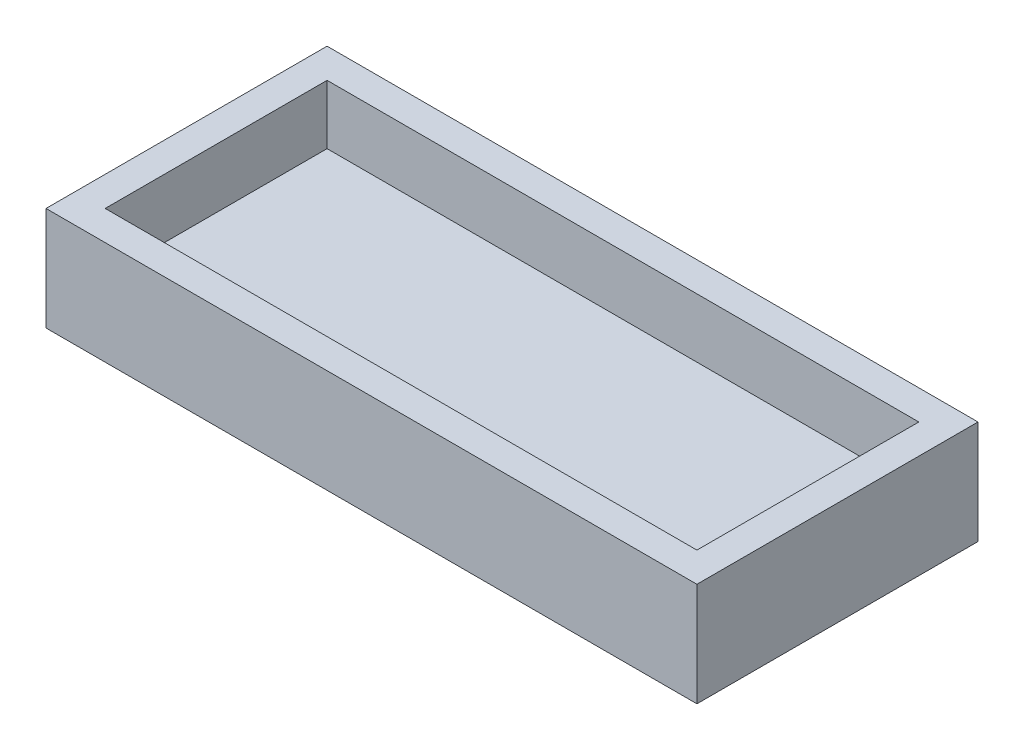
from build123d import *

# Parameters (mm, degrees)
SKETCH1_W           = 40
SKETCH1_H           = 15
BOSS_EXTRUDE1_DEPTH = 3
SKETCH2_W           = 44
SKETCH2_H           = 19
SKETCH2_W_2         = 40
SKETCH2_H_2         = 15
BOSS_EXTRUDE2_DEPTH = 7


with BuildPart() as part:
    # Sketch1 → Boss-Extrude1 (new body)
    with BuildSketch(Plane(origin=(0, 0, 0), x_dir=(1, 0, 0), z_dir=(0, 1, 0))):
        Rectangle(SKETCH1_W, SKETCH1_H)
    extrude(amount=BOSS_EXTRUDE1_DEPTH)

    # Sketch2 → Boss-Extrude2 (add)
    with BuildSketch(Plane.XZ):
        Rectangle(SKETCH2_W, SKETCH2_H)
        Rectangle(SKETCH2_W_2, SKETCH2_H_2, mode=Mode.SUBTRACT)
    extrude(amount=-BOSS_EXTRUDE2_DEPTH)


solid = part.part
